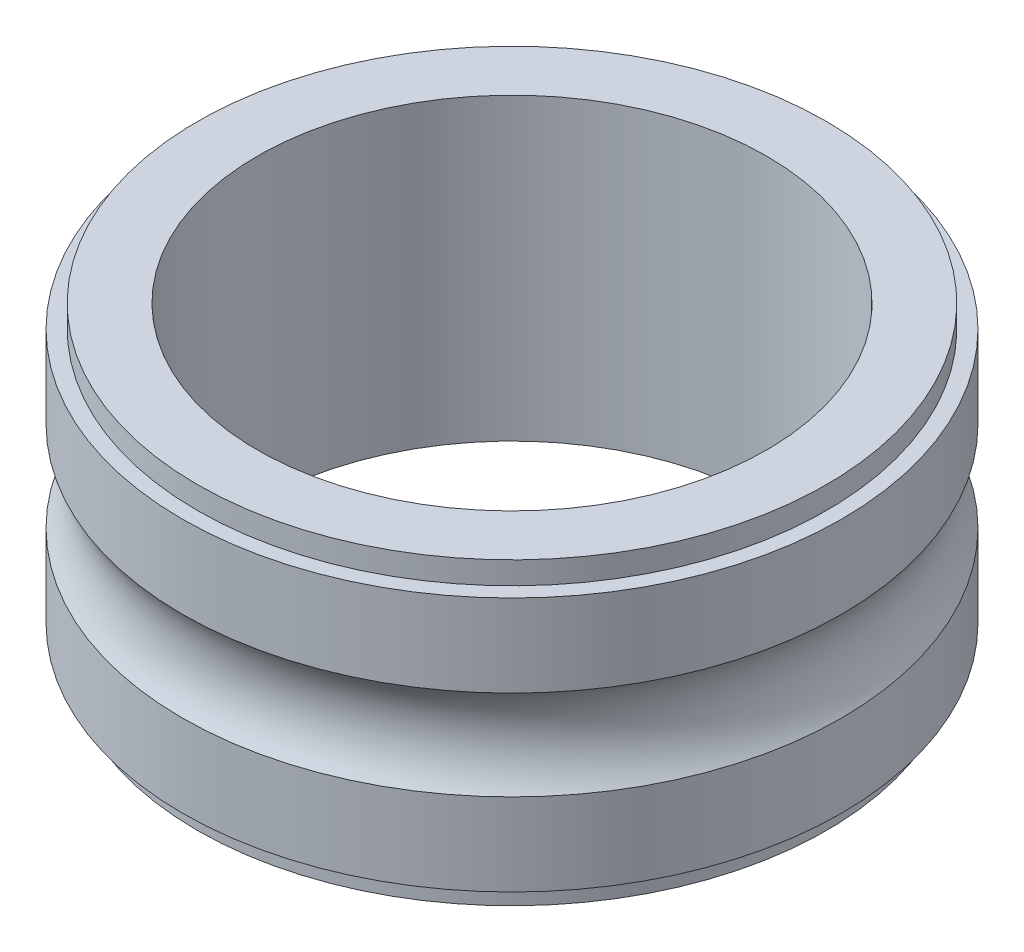
from build123d import *


with BuildPart() as part:
    # Sketch1 → Revolve2 (revolve)
    with BuildSketch(Plane.XY, mode=Mode.PRIVATE) as revolve2_sk:
        with BuildLine():
            Line((11, 4.25), (11, 1.5))
            ThreePointArc((11, 1.5), (10.5, 0), (11, -1.5))
            Line((11, -1.5), (11, -4.25))
            Line((11, -4.25), (10.5, -4.25))
            Line((10.5, -4.25), (10.5, -5))
            Line((10.5, -5), (8.5, -5))
            Line((8.5, -5), (8.5, 5))
            Line((8.5, 5), (10.5, 5))
            Line((10.5, 5), (10.5, 4.25))
            Line((10.5, 4.25), (11, 4.25))
        make_face()
    revolve(revolve2_sk.sketch.rotate(Axis((0, 0, 0), (0, 1, 0)), 90), axis=Axis((0, 0, 0), (0, 1, 0)))


solid = part.part
